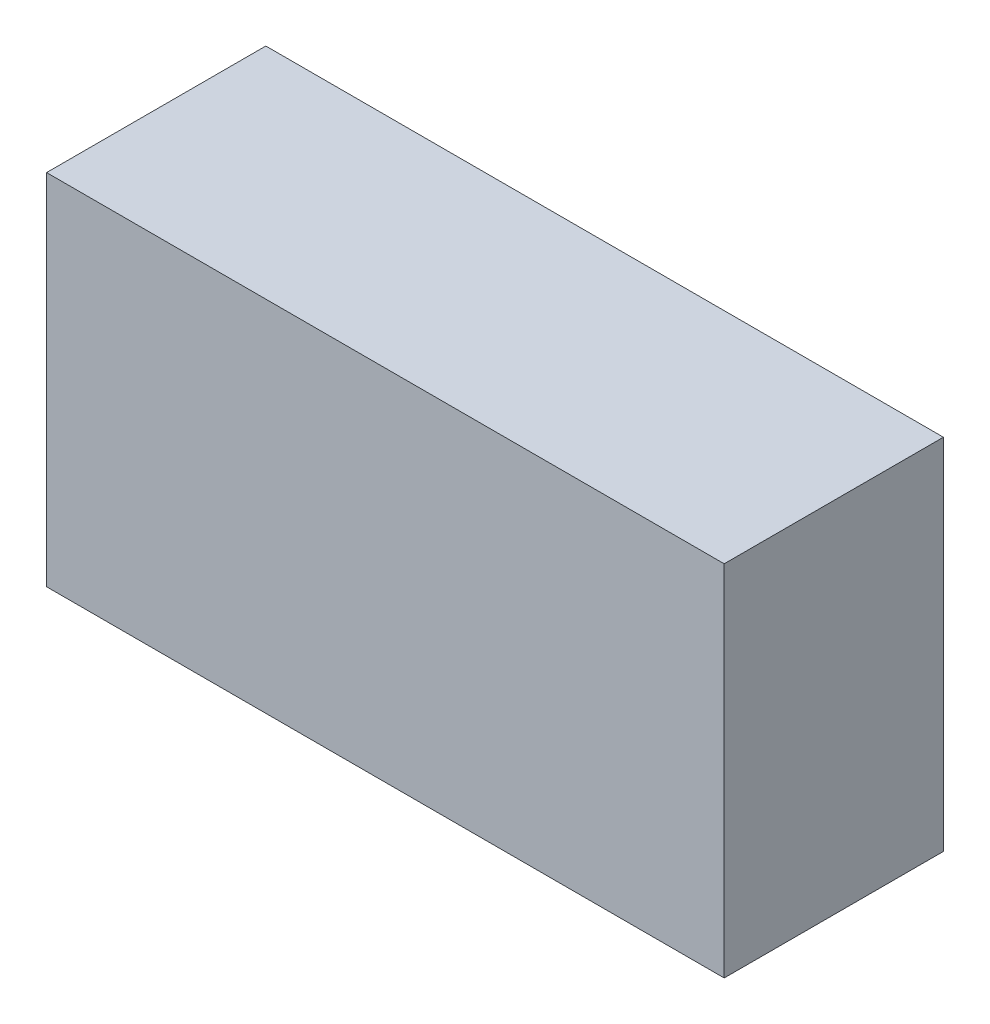
from build123d import *

# Parameters (mm, degrees)
SKETCH1_W           = 34
SKETCH1_H           = 18
BOSS_EXTRUDE1_DEPTH = 11


with BuildPart() as part:
    # Sketch1 → Boss-Extrude1 (new body)
    with BuildSketch(Plane.XY.offset(17)):
        with Locations((20, 14)):
            Rectangle(SKETCH1_W, SKETCH1_H)
    extrude(amount=BOSS_EXTRUDE1_DEPTH)


solid = part.part
